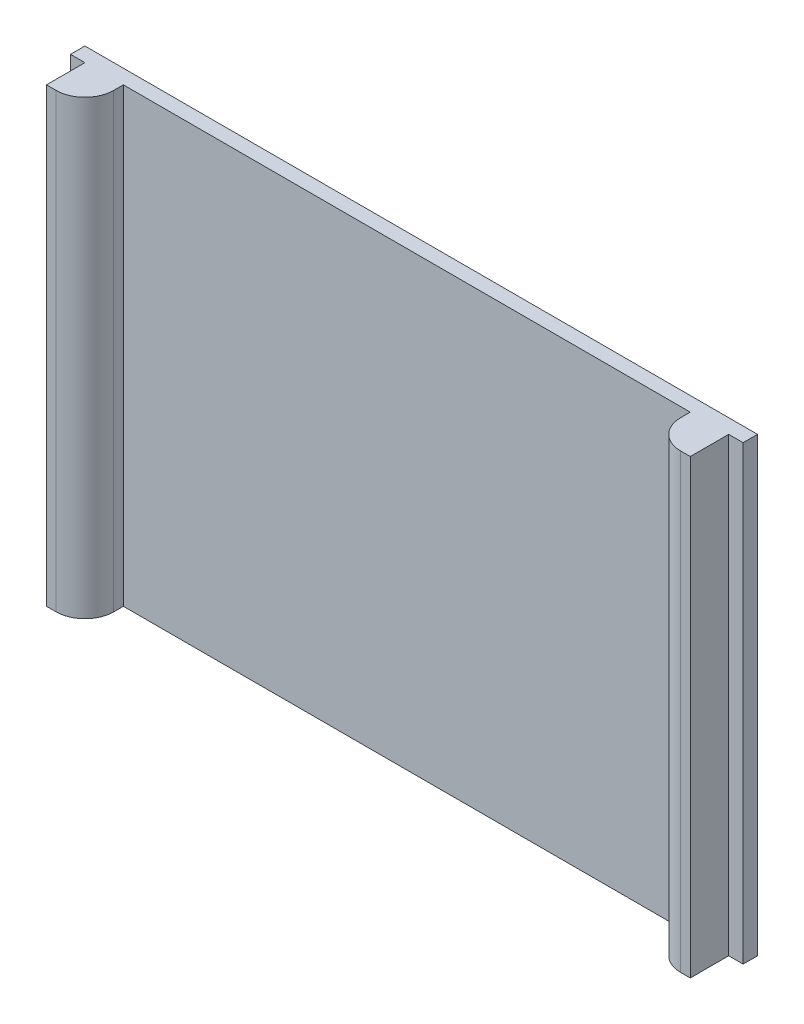
from build123d import *

# Parameters (mm, degrees)
SCHIZZO1_W                   = 700
SCHIZZO1_H                   = 470
ESTRUSIONE_ESTRUSIONE1_DEPTH = 15
SCHIZZO2_W                   = 40
SCHIZZO2_H                   = 470
ESTRUSIONE_ESTRUSIONE2_DEPTH = 40
RACCORDO1_R                  = 30
RACCORDO1_OF_SPECCHIA1_R     = 30


with BuildPart() as part:
    # Schizzo1 → Estrusione-Estrusione1 (new body)
    with BuildSketch(Plane.XY):
        Rectangle(SCHIZZO1_W, SCHIZZO1_H)
    extrude(amount=ESTRUSIONE_ESTRUSIONE1_DEPTH)

    # Schizzo2 → Estrusione-Estrusione2 (add)
    with BuildSketch(Plane.XY.offset(15)):
        with Locations((-315, 0)):
            Rectangle(SCHIZZO2_W, SCHIZZO2_H)
    estrusione_estrusione2 = extrude(amount=ESTRUSIONE_ESTRUSIONE2_DEPTH)

    # Raccordo1
    raccordo1_edges = [part.edges().sort_by_distance(p)[0] for p in [
        (-295, 0, 55),
    ]]
    fillet(raccordo1_edges, radius=RACCORDO1_R)

    # Specchia1: Estrusione-Estrusione2 across plane
    add(estrusione_estrusione2.mirror(Plane(origin=(0, 0, 0), x_dir=(0, 0, 1), z_dir=(1, 0, 0))))

    # Raccordo1 of Specchia1
    raccordo1_of_specchia1_edges = [part.edges().sort_by_distance(p)[0] for p in [
        (295, 0, 55),
    ]]
    fillet(raccordo1_of_specchia1_edges, radius=RACCORDO1_OF_SPECCHIA1_R)


solid = part.part
